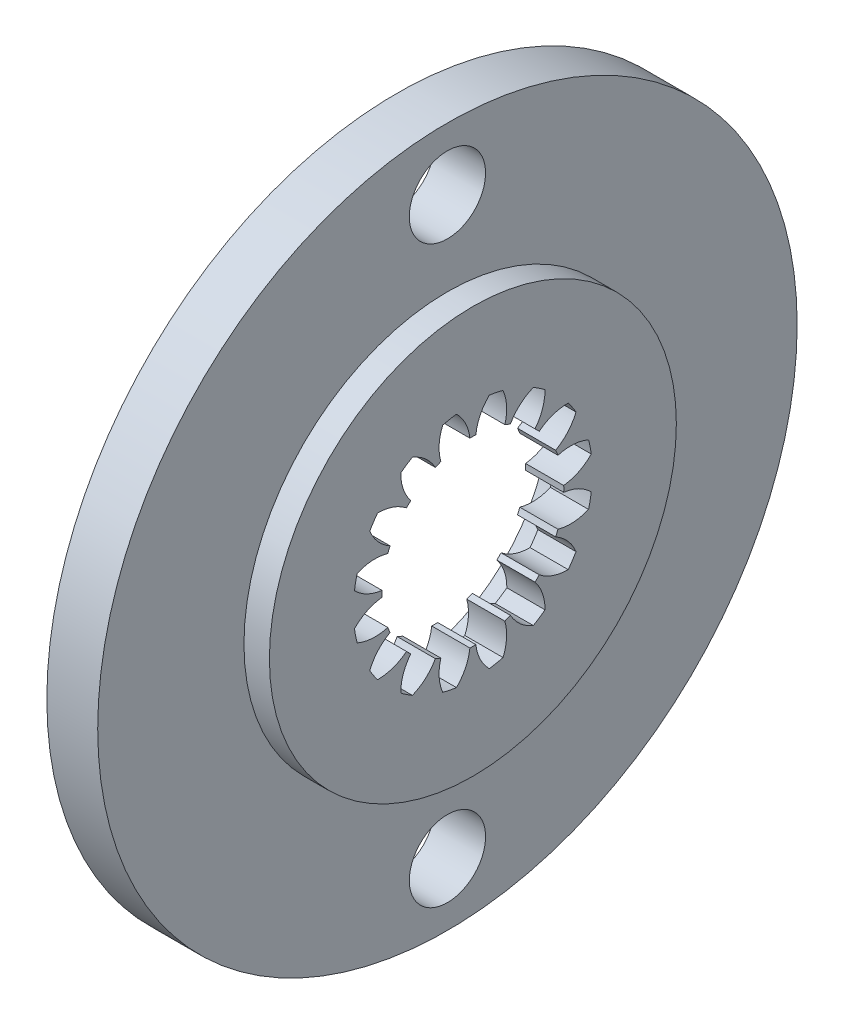
from build123d import *

# Parameters (mm, degrees)
BASPROSKE_W             = 7.5
BASPROSKE_H             = 4.5
TOOTHCUT_DEPTH          = 10.836157786
TEETHCUTS_COUNT         = 16
TEETHCUTS_ANGLE         = 337.5
BORSKE_R                = 2.5
BORE_DEPTH              = 50.0000508
ESQUISSE4_R             = 6
BOSS_EXTRU_3_DEPTH      = 1
ESQUISSE5_R             = 6.027848577
ESQUISSE5_R_2           = 2.85
BOSS_EXTRU_4_DEPTH      = 1
ESQUISSE7_R             = 3.00711341
BOSS_EXTRU_6_DEPTH      = 8.5
ESQUISSE9_R             = 13.75
ESQUISSE9_R_2           = 5.5
BOSS_EXTRU_8_DEPTH      = 2
ESQUISSE10_R            = 1.5
ENL_V_MAT_EXTRU_3_DEPTH = 23.591480695
ESQUISSE11_R            = 3
ENL_V_MAT_EXTRU_4_DEPTH = 4
BOSS_EXTRU_9_START      = 4
ESQUISSE12_R            = 3
BOSS_EXTRU_9_DEPTH      = 4
ESQUISSE13_R            = 5.5
BOSS_EXTRU_10_DEPTH     = 2
ESQUISSE16_R            = 8
BOSS_EXTRU_11_DEPTH     = 1
ESQUISSE14_R            = 6
ENL_V_MAT_EXTRU_5_DEPTH = 1.5
ESQUISSE15_R            = 3.25
ENL_V_MAT_EXTRU_6_DEPTH = 4.5
ENL_V_START             = -4
ESQUISSE17_R            = 6.027848577
ENL_V_MAT_EXTRU_7_DEPTH = 4
ENL_V_MAT_EXTRU_8_DEPTH = 6


with BuildPart() as part:
    # BasProSke → Base-Revolve (revolve)
    with BuildSketch(Plane(origin=(0, 0, 0), x_dir=(1, 0, 0), z_dir=(0, 1, 0)), mode=Mode.PRIVATE) as base_revolve_sk:
        with Locations((3.75, 2.25)):
            Rectangle(BASPROSKE_W, BASPROSKE_H)
    revolve(base_revolve_sk.sketch.rotate(Axis((-10, 0, 0), (1, 0, 0)), 180), axis=Axis((-10, 0, 0), (1, 0, 0)))

    # TooCutSke → ToothCut (cut, through all)
    with BuildSketch(Plane(origin=(0, 0, 0), x_dir=(0, 0, -1), z_dir=(1, 0, 0))):
        with BuildLine():
            ThreePointArc((0.306025637, 3.360092902), (0, 3.374), (-0.306025637, 3.360092902))
            ThreePointArc((-0.306025637, 3.360092902), (-0.415941512, 3.953968919), (-0.738171669, 4.464789776))
            ThreePointArc((-0.738171669, 4.464789776), (0, 4.5254), (0.738171669, 4.464789776))
            ThreePointArc((0.738171669, 4.464789776), (0.415941512, 3.953968919), (0.306025637, 3.360092902))
        make_face()
    toothcut = extrude(amount=TOOTHCUT_DEPTH, mode=Mode.SUBTRACT)

    # TeethCuts: ToothCut ×16 about axis
    teethcuts_axis = Axis((-10, 0, 0), (1, 0, 0))
    for i in range(1, TEETHCUTS_COUNT):
        add(toothcut.rotate(teethcuts_axis, i * TEETHCUTS_ANGLE / (TEETHCUTS_COUNT - 1)), mode=Mode.SUBTRACT)

    # BorSke → Bore (cut, symmetric)
    with BuildSketch(Plane(origin=(0, 0, 0), x_dir=(0, 0, -1), z_dir=(1, 0, 0))):
        with Locations(Location((0, 0, 0), (0, 0, 180))):
            Circle(BORSKE_R)
    extrude(amount=BORE_DEPTH, both=True, mode=Mode.SUBTRACT)

    # Esquisse4 → Boss.-Extru.3 (add)
    with BuildSketch(Plane.ZY):
        Circle(ESQUISSE4_R)
    extrude(amount=BOSS_EXTRU_3_DEPTH)

    # Esquisse5 → Boss.-Extru.4 (add)
    with BuildSketch(Plane(origin=(7.5, 0, 0), x_dir=(0, 0, -1), z_dir=(1, 0, 0))):
        Circle(ESQUISSE5_R)
        Circle(ESQUISSE5_R_2, mode=Mode.SUBTRACT)
    extrude(amount=BOSS_EXTRU_4_DEPTH)

    # Esquisse7 → Boss.-Extru.6 (add)
    with BuildSketch(Plane(origin=(0, 0, 0), x_dir=(0, 0, -1), z_dir=(1, 0, 0))):
        Circle(ESQUISSE7_R)
    extrude(amount=BOSS_EXTRU_6_DEPTH)

    # Esquisse9 → Boss.-Extru.8 (add)
    with BuildSketch(Plane.ZY.offset(1)):
        Circle(ESQUISSE9_R)
        Circle(ESQUISSE9_R_2, mode=Mode.SUBTRACT)
    extrude(amount=BOSS_EXTRU_8_DEPTH)

    # Esquisse10 → Enlèv. mat.-Extru.3 (cut, through all)
    with BuildSketch(Plane.ZY.offset(3)):
        with Locations((0, 11.3)):
            Circle(ESQUISSE10_R)
        with Locations((0, -11.3)):
            Circle(ESQUISSE10_R)
    extrude(amount=-ENL_V_MAT_EXTRU_3_DEPTH, mode=Mode.SUBTRACT)

    # Esquisse11 → Enlèv. mat.-Extru.4 (cut)
    with BuildSketch(Plane.ZY.offset(1)):
        Circle(ESQUISSE11_R)
    extrude(amount=-ENL_V_MAT_EXTRU_4_DEPTH, mode=Mode.SUBTRACT)

    # Esquisse12 → Boss.-Extru.9 (add)
    with BuildSketch(Plane.ZY.offset(-3).offset(BOSS_EXTRU_9_START)):
        Circle(ESQUISSE12_R)
    extrude(amount=-BOSS_EXTRU_9_DEPTH)

    # Esquisse13 → Boss.-Extru.10 (add)
    with BuildSketch(Plane.ZY.offset(1)):
        Circle(ESQUISSE13_R)
    extrude(amount=BOSS_EXTRU_10_DEPTH)

    # Esquisse16 → Boss.-Extru.11 (add)
    with BuildSketch(Plane(origin=(-1, 0, 0), x_dir=(0, 0, -1), z_dir=(1, 0, 0))):
        with Locations(Location((0, 0, 0), (0, 0, 180))):
            Circle(ESQUISSE16_R)
    extrude(amount=BOSS_EXTRU_11_DEPTH)

    # Esquisse14 → Enlèv. mat.-Extru.5 (cut)
    with BuildSketch(Plane.ZY.offset(3)):
        Circle(ESQUISSE14_R)
    extrude(amount=-ENL_V_MAT_EXTRU_5_DEPTH, mode=Mode.SUBTRACT)

    # Esquisse15 → Enlèv. mat.-Extru.6 (cut)
    with BuildSketch(Plane.ZY.offset(1.5)):
        Circle(ESQUISSE15_R)
    extrude(amount=-ENL_V_MAT_EXTRU_6_DEPTH, mode=Mode.SUBTRACT)

    # Esquisse17 → Enlèv. mat.-Extru.7 (cut)
    with BuildSketch(Plane(origin=(8.5, 0, 0), x_dir=(0, 0, -1), z_dir=(1, 0, 0)).offset(ENL_V_START)):
        Circle(ESQUISSE17_R)
    extrude(amount=ENL_V_MAT_EXTRU_7_DEPTH, mode=Mode.SUBTRACT)

    # Esquisse18 → Enlèv. mat.-Extru.8 (cut)
    with BuildSketch(Plane(origin=(4.5, 0, 0), x_dir=(0, 0, -1), z_dir=(1, 0, 0))):
        with BuildLine():
            ThreePointArc((3.572076358, 0.117245432), (4.159283684, 0.287738258), (4.655535919, 0.644969227))
            ThreePointArc((4.655535919, 0.644969227), (4.609690818, 0.916924513), (4.547973386, 1.185722597))
            ThreePointArc((4.547973386, 1.185722597), (3.952789729, 1.325853469), (3.34503612, 1.258653786))
            ThreePointArc((3.34503612, 1.258653786), (3.301945449, 1.367710587), (3.255300351, 1.475295097))
            ThreePointArc((3.255300351, 1.475295097), (3.732564401, 1.857524443), (4.054335311, 2.377470333))
            ThreePointArc((4.054335311, 2.377470333), (3.907907178, 2.611180095), (3.748023133, 2.835898905))
            ThreePointArc((3.748023133, 2.835898905), (3.144519371, 2.737596024), (2.608744456, 2.442934375))
            ThreePointArc((2.608744456, 2.442934375), (2.527199636, 2.527199636), (2.442934375, 2.608744456))
            ThreePointArc((2.442934375, 2.608744456), (2.737596024, 3.144519371), (2.835898905, 3.748023133))
            ThreePointArc((2.835898905, 3.748023133), (2.611180095, 3.907907178), (2.377470333, 4.054335311))
            ThreePointArc((2.377470333, 4.054335311), (1.857524443, 3.732564401), (1.475295097, 3.255300351))
            ThreePointArc((1.475295097, 3.255300351), (1.367710587, 3.301945449), (1.258653786, 3.34503612))
            ThreePointArc((1.258653786, 3.34503612), (1.325853469, 3.952789729), (1.185722597, 4.547973386))
            ThreePointArc((1.185722597, 4.547973386), (0.916924513, 4.609690818), (0.644969227, 4.655535919))
            ThreePointArc((0.644969227, 4.655535919), (0.287738258, 4.159283684), (0.117245432, 3.572076358))
            ThreePointArc((0.117245432, 3.572076358), (0, 3.574), (-0.117245432, 3.572076358))
            ThreePointArc((-0.117245432, 3.572076358), (-0.287738258, 4.159283684), (-0.644969227, 4.655535919))
            ThreePointArc((-0.644969227, 4.655535919), (-0.916924513, 4.609690818), (-1.185722597, 4.547973386))
            ThreePointArc((-1.185722597, 4.547973386), (-1.325853469, 3.952789729), (-1.258653786, 3.34503612))
            ThreePointArc((-1.258653786, 3.34503612), (-1.367710587, 3.301945449), (-1.475295097, 3.255300351))
            ThreePointArc((-1.475295097, 3.255300351), (-1.857524443, 3.732564401), (-2.377470333, 4.054335311))
            ThreePointArc((-2.377470333, 4.054335311), (-2.611180095, 3.907907178), (-2.835898905, 3.748023133))
            ThreePointArc((-2.835898905, 3.748023133), (-2.737596024, 3.144519371), (-2.442934375, 2.608744456))
            ThreePointArc((-2.442934375, 2.608744456), (-2.527199636, 2.527199636), (-2.608744456, 2.442934375))
            ThreePointArc((-2.608744456, 2.442934375), (-3.144519371, 2.737596024), (-3.748023133, 2.835898905))
            ThreePointArc((-3.748023133, 2.835898905), (-3.907907178, 2.611180095), (-4.054335311, 2.377470333))
            ThreePointArc((-4.054335311, 2.377470333), (-3.732564401, 1.857524443), (-3.255300351, 1.475295097))
            ThreePointArc((-3.255300351, 1.475295097), (-3.301945449, 1.367710587), (-3.34503612, 1.258653786))
            ThreePointArc((-3.34503612, 1.258653786), (-3.952789729, 1.325853469), (-4.547973386, 1.185722597))
            ThreePointArc((-4.547973386, 1.185722597), (-4.609690818, 0.916924513), (-4.655535919, 0.644969227))
            ThreePointArc((-4.655535919, 0.644969227), (-4.159283684, 0.287738258), (-3.572076358, 0.117245432))
            ThreePointArc((-3.572076358, 0.117245432), (-3.574, 0), (-3.572076358, -0.117245432))
            ThreePointArc((-3.572076358, -0.117245432), (-4.159283684, -0.287738258), (-4.655535919, -0.644969227))
            ThreePointArc((-4.655535919, -0.644969227), (-4.609690818, -0.916924513), (-4.547973386, -1.185722597))
            ThreePointArc((-4.547973386, -1.185722597), (-3.952789729, -1.325853469), (-3.34503612, -1.258653786))
            ThreePointArc((-3.34503612, -1.258653786), (-3.301945449, -1.367710587), (-3.255300351, -1.475295097))
            ThreePointArc((-3.255300351, -1.475295097), (-3.732564401, -1.857524443), (-4.054335311, -2.377470333))
            ThreePointArc((-4.054335311, -2.377470333), (-3.907907178, -2.611180095), (-3.748023133, -2.835898905))
            ThreePointArc((-3.748023133, -2.835898905), (-3.144519371, -2.737596024), (-2.608744456, -2.442934375))
            ThreePointArc((-2.608744456, -2.442934375), (-2.527199636, -2.527199636), (-2.442934375, -2.608744456))
            ThreePointArc((-2.442934375, -2.608744456), (-2.737596024, -3.144519371), (-2.835898905, -3.748023133))
            ThreePointArc((-2.835898905, -3.748023133), (-2.611180095, -3.907907178), (-2.377470333, -4.054335311))
            ThreePointArc((-2.377470333, -4.054335311), (-1.857524443, -3.732564401), (-1.475295097, -3.255300351))
            ThreePointArc((-1.475295097, -3.255300351), (-1.367710587, -3.301945449), (-1.258653786, -3.34503612))
            ThreePointArc((-1.258653786, -3.34503612), (-1.325853469, -3.952789729), (-1.185722597, -4.547973386))
            ThreePointArc((-1.185722597, -4.547973386), (-0.916924513, -4.609690818), (-0.644969227, -4.655535919))
            ThreePointArc((-0.644969227, -4.655535919), (-0.287738258, -4.159283684), (-0.117245432, -3.572076358))
            ThreePointArc((-0.117245432, -3.572076358), (0, -3.574), (0.117245432, -3.572076358))
            ThreePointArc((0.117245432, -3.572076358), (0.287738258, -4.159283684), (0.644969227, -4.655535919))
            ThreePointArc((0.644969227, -4.655535919), (0.916924513, -4.609690818), (1.185722597, -4.547973386))
            ThreePointArc((1.185722597, -4.547973386), (1.325853469, -3.952789729), (1.258653786, -3.34503612))
            ThreePointArc((1.258653786, -3.34503612), (1.367710587, -3.301945449), (1.475295097, -3.255300351))
            ThreePointArc((1.475295097, -3.255300351), (1.857524443, -3.732564401), (2.377470333, -4.054335311))
            ThreePointArc((2.377470333, -4.054335311), (2.611180095, -3.907907178), (2.835898905, -3.748023133))
            ThreePointArc((2.835898905, -3.748023133), (2.737596024, -3.144519371), (2.442934375, -2.608744456))
            ThreePointArc((2.442934375, -2.608744456), (2.527199636, -2.527199636), (2.608744456, -2.442934375))
            ThreePointArc((2.608744456, -2.442934375), (3.144519371, -2.737596024), (3.748023133, -2.835898905))
            ThreePointArc((3.748023133, -2.835898905), (3.907907178, -2.611180095), (4.054335311, -2.377470333))
            ThreePointArc((4.054335311, -2.377470333), (3.732564401, -1.857524443), (3.255300351, -1.475295097))
            ThreePointArc((3.255300351, -1.475295097), (3.301945449, -1.367710587), (3.34503612, -1.258653786))
            ThreePointArc((3.34503612, -1.258653786), (3.952789729, -1.325853469), (4.547973386, -1.185722597))
            ThreePointArc((4.547973386, -1.185722597), (4.609690818, -0.916924513), (4.655535919, -0.644969227))
            ThreePointArc((4.655535919, -0.644969227), (4.159283684, -0.287738258), (3.572076358, -0.117245432))
            ThreePointArc((3.572076358, -0.117245432), (3.574, 0), (3.572076358, 0.117245432))
        make_face()
    extrude(amount=-ENL_V_MAT_EXTRU_8_DEPTH, mode=Mode.SUBTRACT)


solid = part.part
